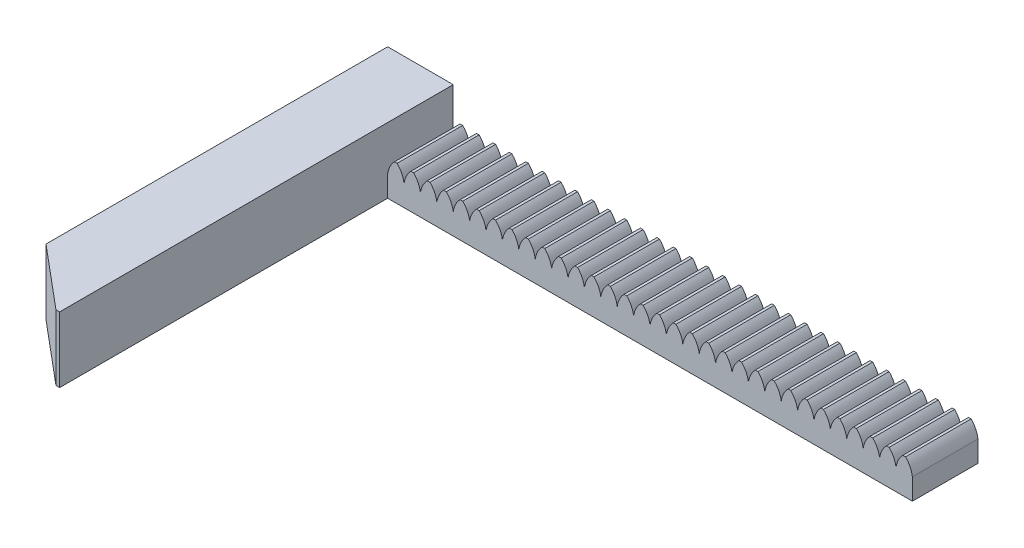
from build123d import *

# Parameters (mm, degrees)
BOSS_EXTRUDE1_DEPTH = 10
CUT_EXTRUDE4_DEPTH  = 10
LPATTERN2_COUNT     = 32
LPATTERN2_PITCH     = 2.5


with BuildPart() as part:
    # Sketch1 → Boss-Extrude1 (new body)
    with BuildSketch(Plane(origin=(0, 0, 0), x_dir=(1, 0, 0), z_dir=(0, 1, 0))):
        Polygon((-50, -47.085841971), (-40.568273737, -55), (-40, -55), (-40, -5), (40, -5), (40, 5), (-40, 5), (-50, 5), align=None)
    extrude(amount=BOSS_EXTRUDE1_DEPTH)

    # Sketch5 → Cut-Extrude4 (cut)
    with BuildSketch(Plane.XY.offset(5)):
        with BuildLine():
            Line((40, 10), (37.5, 10))
            Line((37.5, 10), (37.5, 3.221403126))
            ThreePointArc((37.5, 3.221403126), (37.853347708, 4.366700719), (38.55, 5.342014394))
            Line((38.55, 5.342014394), (38.95, 5.342014394))
            ThreePointArc((38.95, 5.342014394), (39.646652292, 4.366700719), (40, 3.221403126))
            Line((40, 3.221403126), (40, 10))
        make_face()
    cut_extrude4 = extrude(amount=-CUT_EXTRUDE4_DEPTH, mode=Mode.SUBTRACT)

    # LPattern2: Cut-Extrude4 ×32
    with Locations(*[(-i * LPATTERN2_PITCH, 0, 0) for i in range(1, LPATTERN2_COUNT)]):
        add(cut_extrude4, mode=Mode.SUBTRACT)


solid = part.part
